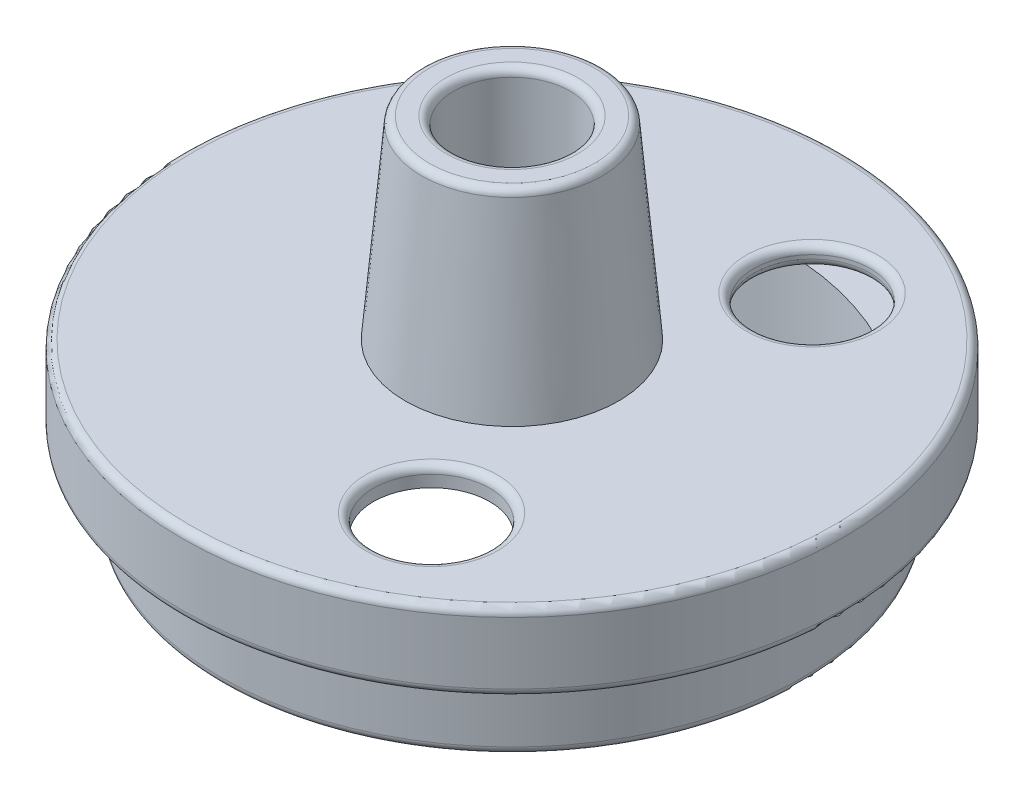
from build123d import *

# Parameters (mm, degrees)
CUT_EXTRUDE1_REACH  = 14.669
SKETCH2_R           = 1.5
BOSS_EXTRUDE1_START = 5
SKETCH3_R           = 2.75
SKETCH3_R_2         = 1.5
BOSS_EXTRUDE1_DEPTH = 5
DRAFT2_ANGLE        = 5
FILLET1_R           = 0.2


with BuildPart() as part:
    # Sketch1 → Revolve1 (revolve)
    with BuildSketch(Plane(origin=(0, 0, 0), x_dir=(0, 0, -1), z_dir=(1, 0, 0))):
        Polygon((-8.5, -2), (-7.5, -2), (-7.5, -4), (-7, -4), (-7, -1.5), (-8, -1.5), (-8, -0.5), (0, -0.5), (0, 0), (-8.5, 0), align=None)
    revolve(axis=Axis((0, 0, 0), (0, -1, 0)))

    # Sketch2 → Cut-Extrude1 (cut, up to next)
    with BuildSketch(Plane(origin=(0, 0, 0), x_dir=(1, 0, 0), z_dir=(0, 1, 0)), mode=Mode.PRIVATE) as cut_extrude1_sk1:
        with Locations(Location((2.833333333, 4.907477288, 0), (0, 0, 270))):
            Circle(SKETCH2_R)
    cut_extrude1_tool1 = extrude(cut_extrude1_sk1.sketch, amount=-CUT_EXTRUDE1_REACH, mode=Mode.PRIVATE) & part.part
    # Sketch2 → Cut-Extrude1 (cut, up to next)
    with BuildSketch(Plane(origin=(0, 0, 0), x_dir=(1, 0, 0), z_dir=(0, 1, 0)), mode=Mode.PRIVATE) as cut_extrude1_sk2:
        with Locations(Location((0, 0, 0), (0, 0, 270))):
            Circle(SKETCH2_R)
    cut_extrude1_tool2 = extrude(cut_extrude1_sk2.sketch, amount=-CUT_EXTRUDE1_REACH, mode=Mode.PRIVATE) & part.part
    # Sketch2 → Cut-Extrude1 (cut, up to next)
    with BuildSketch(Plane(origin=(0, 0, 0), x_dir=(1, 0, 0), z_dir=(0, 1, 0)), mode=Mode.PRIVATE) as cut_extrude1_sk3:
        with Locations(Location((2.833333333, -4.907477288, 0), (0, 0, 270))):
            Circle(SKETCH2_R)
    cut_extrude1_tool3 = extrude(cut_extrude1_sk3.sketch, amount=-CUT_EXTRUDE1_REACH, mode=Mode.PRIVATE) & part.part
    add(cut_extrude1_tool1.solids().sort_by_distance((2.833333, 0, -4.907477))[0], mode=Mode.SUBTRACT)
    add(cut_extrude1_tool2.solids().sort_by_distance((0, 0, 0))[0], mode=Mode.SUBTRACT)
    add(cut_extrude1_tool3.solids().sort_by_distance((2.833333, 0, 4.907477))[0], mode=Mode.SUBTRACT)

    # Sketch3 → Boss-Extrude1 (add)
    with BuildSketch(Plane(origin=(0, 0, 0), x_dir=(1, 0, 0), z_dir=(0, 1, 0)).offset(BOSS_EXTRUDE1_START)):
        with Locations(Location((0, 0, 0), (0, 0, 270))):
            Circle(SKETCH3_R)
        with Locations(Location((0, 0, 0), (0, 0, 270))):
            Circle(SKETCH3_R_2, mode=Mode.SUBTRACT)
    extrude(amount=-BOSS_EXTRUDE1_DEPTH)

    # Draft2
    draft2_faces = [part.faces().sort_by_distance(p)[0] for p in [
        (0, 2.5, -2.75),
    ]]
    draft(draft2_faces, Plane.ZX, DRAFT2_ANGLE)

    # Fillet1
    fillet1_edges = [part.edges().sort_by_distance(p)[0] for p in [
        (0, -2, -8.5),
        (0, 0, -8.5),
        (2.833333333, 0, -6.407477288),
        (2.833333333, -0.5, -6.407477288),
        (2.833333333, 0, 3.407477288),
        (0, 5, -2.312556682),
        (0, 5, -1.5),
        (0, -4, -7),
        (0, -4, -7.5),
    ]]
    fillet(fillet1_edges, radius=FILLET1_R)


solid = part.part
